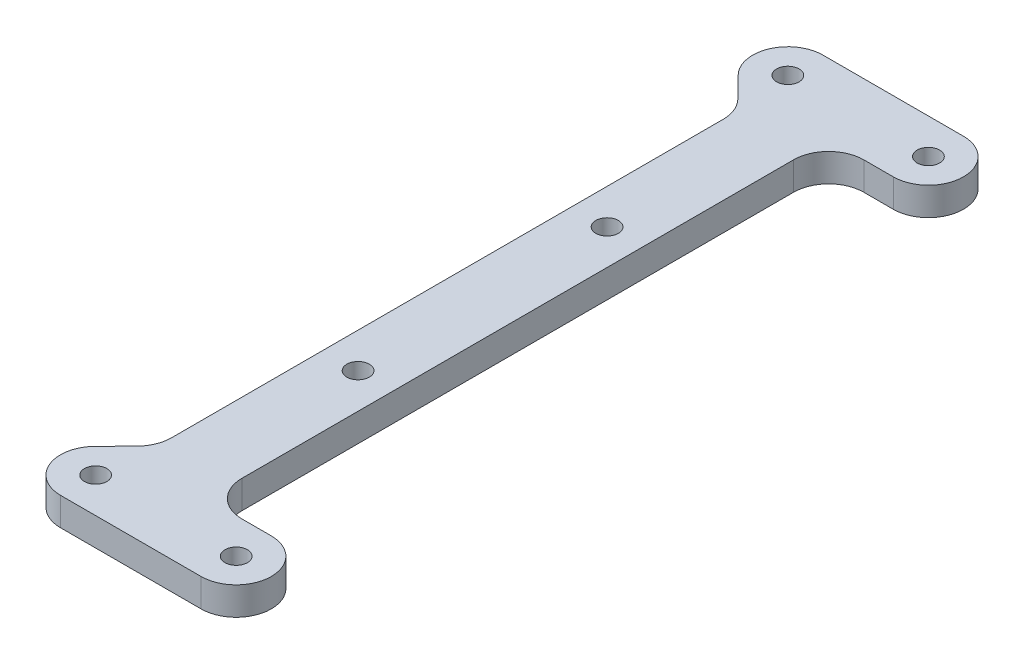
from build123d import *

# Parameters (mm, degrees)
SKETCH1_R           = 1.6
BOSS_EXTRUDE1_DEPTH = 4


with BuildPart() as part:
    # Sketch1 → Boss-Extrude1 (new body)
    with BuildSketch(Plane(origin=(0, 0, 0), x_dir=(1, 0, 0), z_dir=(0, 1, 0))):
        with BuildLine():
            Line((10, 54.25), (-10, 54.25))
            ThreePointArc((-10, 54.25), (-14.611555285, 51.182241665), (-13.564255704, 45.74342314))
            Line((-13.564255704, 45.74342314), (-10.625744296, 42.75657686))
            ThreePointArc((-10.625744296, 42.75657686), (-9.562836802, 41.14456083), (-9.19, 39.25))
            Line((-9.19, 39.25), (-9.19, -39.25))
            ThreePointArc((-9.19, -39.25), (-9.562836802, -41.14456083), (-10.625744296, -42.75657686))
            Line((-10.625744296, -42.75657686), (-13.564255704, -45.74342314))
            ThreePointArc((-13.564255704, -45.74342314), (-14.611555285, -51.182241665), (-10, -54.25))
            Line((-10, -54.25), (10, -54.25))
            ThreePointArc((10, -54.25), (15, -49.25), (10, -44.25))
            Line((10, -44.25), (5.81, -44.25))
            ThreePointArc((5.81, -44.25), (2.274466094, -42.785533906), (0.81, -39.25))
            Line((0.81, -39.25), (0.81, 39.25))
            ThreePointArc((0.81, 39.25), (2.274466094, 42.785533906), (5.81, 44.25))
            Line((5.81, 44.25), (10, 44.25))
            ThreePointArc((10, 44.25), (15, 49.25), (10, 54.25))
        make_face()
        with Locations(Location((-10, 49.25, 0), (0, 0, 270))):
            Circle(SKETCH1_R, mode=Mode.SUBTRACT)
        with Locations(Location((10, 49.25, 0), (0, 0, 270))):
            Circle(SKETCH1_R, mode=Mode.SUBTRACT)
        with Locations(Location((-4.19, -17.715, 0), (0, 0, 270))):
            Circle(SKETCH1_R, mode=Mode.SUBTRACT)
        with Locations(Location((-4.19, 17.715, 0), (0, 0, 270))):
            Circle(SKETCH1_R, mode=Mode.SUBTRACT)
        with Locations(Location((10, -49.25, 0), (0, 0, 270))):
            Circle(SKETCH1_R, mode=Mode.SUBTRACT)
        with Locations(Location((-10, -49.25, 0), (0, 0, 270))):
            Circle(SKETCH1_R, mode=Mode.SUBTRACT)
    extrude(amount=BOSS_EXTRUDE1_DEPTH)


solid = part.part
